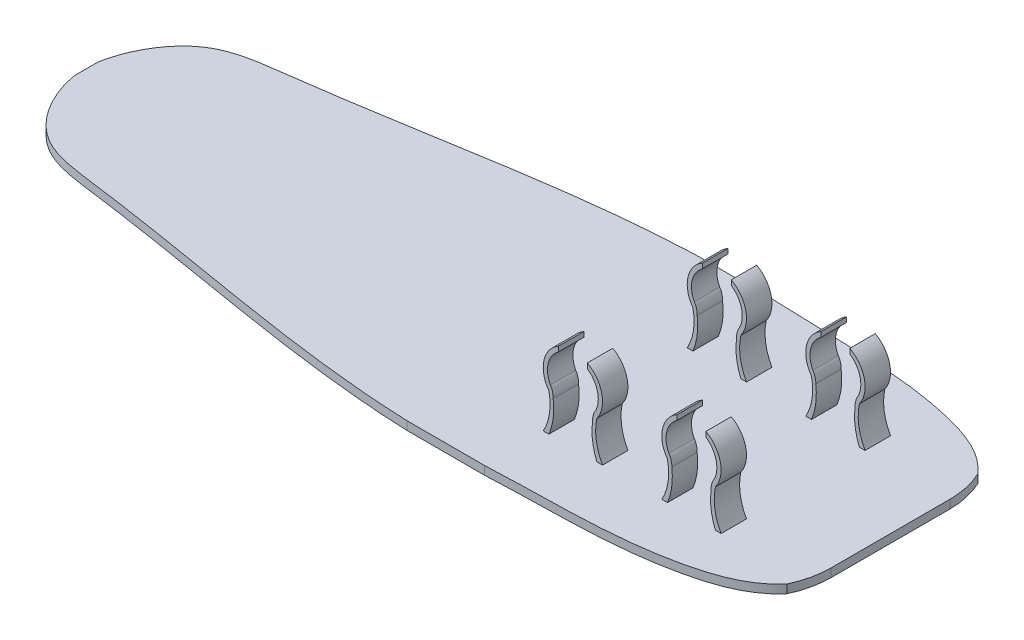
from build123d import *

# Parameters (mm, degrees)
SKETCH1_W               = 0.095
SKETCH1_H               = 0.034
BOSS_EXTRUDE1_DEPTH     = 0.001
FILLET1_R               = 0.01
SKETCH2_W               = 0.108390118
SKETCH2_H               = 0.054610256
CUT_EXTRUDE1_DEPTH      = 1.100905897
SKETCH3_W               = 0.007
SKETCH3_H               = 0.02
BOSS_EXTRUDE3_DEPTH     = 0.01
CUT_EXTRUDE3_DEPTH      = 0.02
CUT_EXTRUDE4_DEPTH      = 1.101451623
CUT_EXTRUDE4_DEPTH_BACK = 1.101451623
SKETCH7_W               = 0.014
SKETCH7_H               = 0.009554802


with BuildPart() as part:
    # Sketch1 → Boss-Extrude1 (new body)
    with BuildSketch(Plane(origin=(0, 0, 0), x_dir=(1, 0, 0), z_dir=(0, 1, 0))):
        with Locations((0.0475, 0.017)):
            Rectangle(SKETCH1_W, SKETCH1_H)
    extrude(amount=BOSS_EXTRUDE1_DEPTH)

    # Fillet1
    fillet1_edges = [part.edges().sort_by_distance(p)[0] for p in [
        (0, 0.0005, -0.034),
        (0.095, 0.0005, -0.034),
        (0.095, 0.0005, 0),
        (0, 0.0005, 0),
    ]]
    fillet(fillet1_edges, radius=FILLET1_R)

    # Sketch2 → Cut-Extrude1 (cut, through all)
    with BuildSketch(Plane(origin=(0, 0.001, 0), x_dir=(1, 0, 0), z_dir=(0, 1, 0))):
        with Locations((0.049758636, 0.016186973)):
            Rectangle(SKETCH2_W, SKETCH2_H)
        with BuildLine():
            Line((0.094046251, 0.005737919), (0.101650765, 0.018950026))
            Line((0.101650765, 0.018950026), (0.094046251, 0.028262081))
            add(Edge.make_bspline(
                [(0.064084184, 0.034), (0.071551733, 0.033625438), (0.082028445, 0.034184392), (0.092096236, 0.030531944), (0.094046251, 0.028262081)],
                knots=[0, 0, 0, 0, 0.721120643, 1, 1, 1, 1], degree=3))
            add(Edge.make_bspline(
                [(0.064084184, 0.034), (0.045412447, 0.034768462), (0.027756497, 0.029991547), (0.003689483, 0.027265226), (0.000489692, 0.021368685), (0, 0.018392895)],
                knots=[0, 0, 0, 0, 0.755062612, 0.862055371, 1, 1, 1, 1], degree=3))
            Line((0, 0.018392895), (-0.003277689, 0.017))
            Line((-0.003277689, 0.017), (0, 0.015607105))
            add(Edge.make_bspline(
                [(0.064084184, 0), (0.045412447, -0.000768462), (0.027756497, 0.004008453), (0.003689483, 0.006734774), (0.000489692, 0.012631315), (0, 0.015607105)],
                knots=[0, 0, 0, 0, 0.755062612, 0.862055371, 1, 1, 1, 1], degree=3))
            add(Edge.make_bspline(
                [(0.064084184, 0), (0.071551733, 0.000374562), (0.082028445, -0.000184392), (0.092096236, 0.003468056), (0.094046251, 0.005737919)],
                knots=[0, 0, 0, 0, 0.721120643, 1, 1, 1, 1], degree=3))
        make_face(mode=Mode.SUBTRACT)
    extrude(amount=-CUT_EXTRUDE1_DEPTH, mode=Mode.SUBTRACT)

    # Sketch3 → Boss-Extrude3 (add)
    with BuildSketch(Plane(origin=(0, 0.001, 0), x_dir=(1, 0, 0), z_dir=(0, 1, 0))):
        with Locations((0.0675, 0.017)):
            Rectangle(SKETCH3_W, SKETCH3_H)
        with Locations((0.0815, 0.017)):
            Rectangle(SKETCH3_W, SKETCH3_H)
    extrude(amount=BOSS_EXTRUDE3_DEPTH)

    # Sketch6 → Cut-Extrude3 (cut)
    with BuildSketch(Plane.XY.offset(-0.007)):
        with BuildLine():
            ThreePointArc((0.064669534, 0.005441248), (0.06417159, 0.006417556), (0.064, 0.0075))
            Line((0.064, 0.0075), (0.064, 0.001))
            ThreePointArc((0.064, 0.001), (0.064742524, 0.003159153), (0.064669534, 0.005441248))
        make_face()
        with BuildLine():
            Line((0.071, 0.001), (0.071, 0.0075))
            ThreePointArc((0.071, 0.0075), (0.07082841, 0.006417556), (0.070330466, 0.005441248))
            ThreePointArc((0.070330466, 0.005441248), (0.070257476, 0.003159153), (0.071, 0.001))
        make_face()
        with BuildLine():
            ThreePointArc((0.078669534, 0.005441248), (0.07817159, 0.006417556), (0.078, 0.0075))
            Line((0.078, 0.0075), (0.078, 0.001))
            ThreePointArc((0.078, 0.001), (0.078742524, 0.003159153), (0.078669534, 0.005441248))
        make_face()
        with BuildLine():
            Line((0.085, 0.001), (0.085, 0.0075))
            ThreePointArc((0.085, 0.0075), (0.08482841, 0.006417556), (0.084330466, 0.005441248))
            ThreePointArc((0.084330466, 0.005441248), (0.084257476, 0.003159153), (0.085, 0.001))
        make_face()
        with BuildLine():
            Line((0.07979173, 0.010554802), (0.07979173, 0.009966133))
            ThreePointArc((0.07979173, 0.009966133), (0.078586333, 0.008214524), (0.078844606, 0.006103977))
            add(Edge.make_bspline(
                [(0.079174329, 0.00488442), (0.079202793, 0.005073177), (0.079117093, 0.005495288), (0.079003836, 0.00591296), (0.078844606, 0.006103977)],
                knots=[0, 0, 0, 0, 0.436991864, 1, 1, 1, 1], degree=3))
            ThreePointArc((0.079174329, 0.00488442), (0.079180203, 0.002908647), (0.078669534, 0.001))
            Line((0.078669534, 0.001), (0.084330466, 0.001))
            ThreePointArc((0.084330466, 0.001), (0.083819797, 0.002908647), (0.083825671, 0.00488442))
            add(Edge.make_bspline(
                [(0.083825671, 0.00488442), (0.083797207, 0.005073177), (0.083882907, 0.005495288), (0.083996164, 0.00591296), (0.084155394, 0.006103977)],
                knots=[0, 0, 0, 0, 0.436991864, 1, 1, 1, 1], degree=3))
            ThreePointArc((0.084155394, 0.006103977), (0.084413667, 0.008214524), (0.08320827, 0.009966133))
            Line((0.08320827, 0.009966133), (0.08320827, 0.010554802))
            ThreePointArc((0.08320827, 0.010554802), (0.084519018, 0.009270742), (0.085, 0.0075))
            Line((0.085, 0.0075), (0.085, 0.011))
            Line((0.085, 0.011), (0.078, 0.011))
            Line((0.078, 0.011), (0.078, 0.0075))
            ThreePointArc((0.078, 0.0075), (0.078480982, 0.009270742), (0.07979173, 0.010554802))
        make_face()
        with BuildLine():
            Line((0.06579173, 0.010554802), (0.06579173, 0.009966133))
            ThreePointArc((0.06579173, 0.009966133), (0.064586333, 0.008214524), (0.064844606, 0.006103977))
            add(Edge.make_bspline(
                [(0.065174329, 0.00488442), (0.065202793, 0.005073177), (0.065117093, 0.005495288), (0.065003836, 0.00591296), (0.064844606, 0.006103977)],
                knots=[0, 0, 0, 0, 0.436991864, 1, 1, 1, 1], degree=3))
            ThreePointArc((0.065174329, 0.00488442), (0.065180203, 0.002908647), (0.064669534, 0.001))
            Line((0.064669534, 0.001), (0.070330466, 0.001))
            ThreePointArc((0.070330466, 0.001), (0.069819797, 0.002908647), (0.069825671, 0.00488442))
            add(Edge.make_bspline(
                [(0.069825671, 0.00488442), (0.069797207, 0.005073177), (0.069882907, 0.005495288), (0.069996164, 0.00591296), (0.070155394, 0.006103977)],
                knots=[0, 0, 0, 0, 0.436991864, 1, 1, 1, 1], degree=3))
            ThreePointArc((0.070155394, 0.006103977), (0.070413667, 0.008214524), (0.06920827, 0.009966133))
            Line((0.06920827, 0.009966133), (0.06920827, 0.010554802))
            ThreePointArc((0.06920827, 0.010554802), (0.070519018, 0.009270742), (0.071, 0.0075))
            Line((0.071, 0.0075), (0.071, 0.011))
            Line((0.071, 0.011), (0.064, 0.011))
            Line((0.064, 0.011), (0.064, 0.0075))
            ThreePointArc((0.064, 0.0075), (0.064480982, 0.009270742), (0.06579173, 0.010554802))
        make_face()
    extrude(amount=-CUT_EXTRUDE3_DEPTH, mode=Mode.SUBTRACT)

    # Sketch7 → Cut-Extrude4 (cut, two sides: drawn at the far end of the back side and taken through both)
    with BuildSketch(Plane(origin=(0, 0, 0), x_dir=(0, 0, -1), z_dir=(1, 0, 0)).offset(-CUT_EXTRUDE4_DEPTH_BACK)):
        with Locations((0.017, 0.005777401)):
            Rectangle(SKETCH7_W, SKETCH7_H)
    extrude(amount=CUT_EXTRUDE4_DEPTH + CUT_EXTRUDE4_DEPTH_BACK, mode=Mode.SUBTRACT)


solid = part.part
